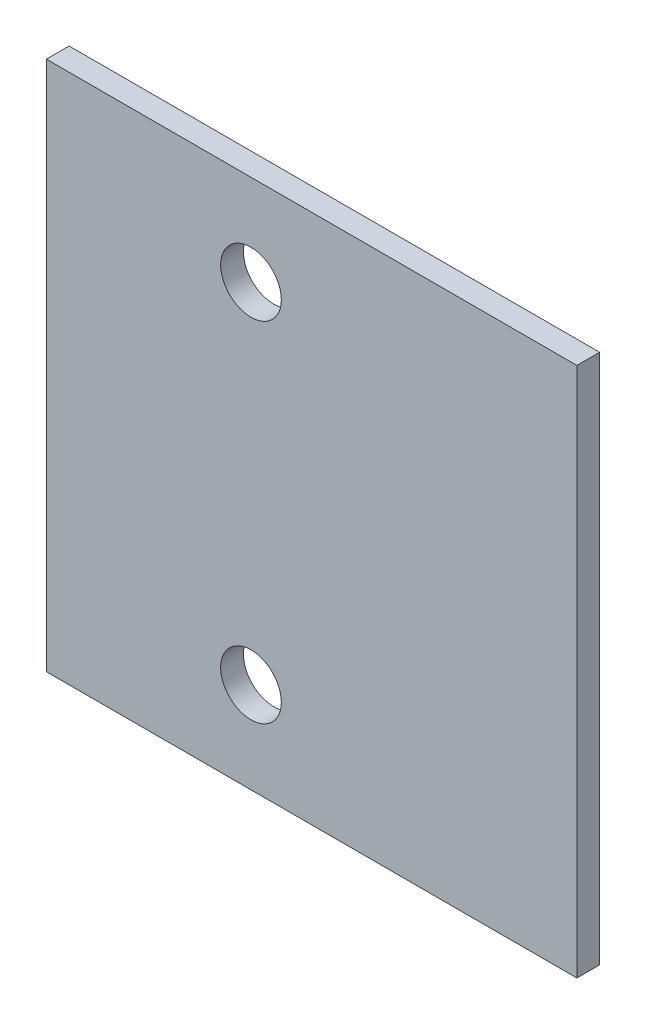
from build123d import *

# Parameters (mm, degrees)
SKETCH1_W           = 70
SKETCH1_H           = 70
SKETCH1_R           = 4
BOSS_EXTRUDE1_DEPTH = 1.5


with BuildPart() as part:
    # Sketch1 → Boss-Extrude1 (new, symmetric)
    with BuildSketch(Plane.XY):
        Rectangle(SKETCH1_W, SKETCH1_H)
        with Locations((-8, -23)):
            Circle(SKETCH1_R, mode=Mode.SUBTRACT)
        with Locations((-8, 23)):
            Circle(SKETCH1_R, mode=Mode.SUBTRACT)
    extrude(amount=BOSS_EXTRUDE1_DEPTH, both=True)


solid = part.part
